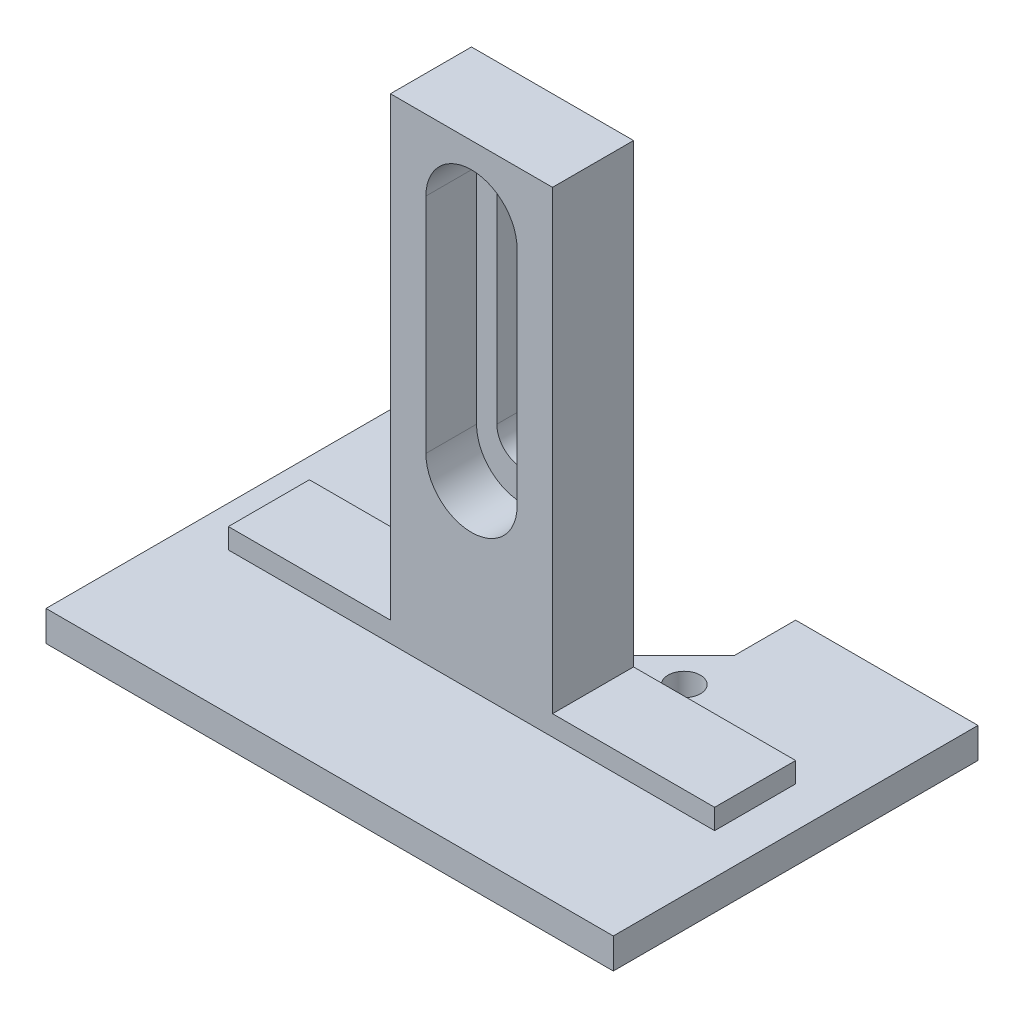
from build123d import *

# Parameters (mm, degrees)
SKETCH_2_R          = 1.6
EXTRUDE_2_DEPTH     = 3
SKETCH_3_W          = 48
SKETCH_3_H          = 8
EXTRUDE_3_DEPTH     = 2
SKETCH_4_W          = 16
SKETCH_4_H          = 8
EXTRUDE_4_DEPTH     = 45
CUT_EXTRUDE_1_DEPTH = 59.966091951
CUT_EXTRUDE_2_DEPTH = 5


with BuildPart() as part:
    # 草图2 → 凸台-拉伸2 (new body)
    with BuildSketch(Plane(origin=(0, 0, 0), x_dir=(1, 0, 0), z_dir=(0, 1, 0))):
        Polygon((-28, 36), (-10, 36), (-10, 29.949747468), (-3.450252532, 23.4), (3.450252532, 23.4), (10, 29.949747468), (10, 36), (28, 36), (28, 0), (-28, 0), align=None)
        with Locations(Location((-10, 25, 0), (0, 0, 270))):
            Circle(SKETCH_2_R, mode=Mode.SUBTRACT)
        with Locations(Location((10, 25, 0), (0, 0, 270))):
            Circle(SKETCH_2_R, mode=Mode.SUBTRACT)
    extrude(amount=-EXTRUDE_2_DEPTH)

    # 草图3 → 凸台-拉伸3 (add)
    with BuildSketch(Plane(origin=(0, 0, 0), x_dir=(1, 0, 0), z_dir=(0, 1, 0))):
        with Locations((0, 18)):
            Rectangle(SKETCH_3_W, SKETCH_3_H)
    extrude(amount=EXTRUDE_3_DEPTH)

    # 草图4 → 凸台-拉伸4 (add)
    with BuildSketch(Plane(origin=(0, 2, 0), x_dir=(1, 0, 0), z_dir=(0, 1, 0))):
        with Locations((0, 18)):
            Rectangle(SKETCH_4_W, SKETCH_4_H)
    extrude(amount=EXTRUDE_4_DEPTH)

    # 草图5 → 切除-拉伸1 (cut, through all)
    with BuildSketch(Plane.XY.offset(-14)):
        with BuildLine():
            Line((2.5, 39), (2.5, 19))
            ThreePointArc((2.5, 19), (0, 16.5), (-2.5, 19))
            Line((-2.5, 19), (-2.5, 39))
            ThreePointArc((-2.5, 39), (0, 41.5), (2.5, 39))
        make_face()
    extrude(amount=-CUT_EXTRUDE_1_DEPTH, mode=Mode.SUBTRACT)

    # 草图6 → 切除-拉伸2 (cut)
    with BuildSketch(Plane.XY.offset(-14)):
        with BuildLine():
            Line((4.5, 40), (4.5, 18))
            ThreePointArc((4.5, 18), (0, 13.5), (-4.5, 18))
            Line((-4.5, 18), (-4.5, 40))
            ThreePointArc((-4.5, 40), (0, 44.5), (4.5, 40))
        make_face()
    extrude(amount=-CUT_EXTRUDE_2_DEPTH, mode=Mode.SUBTRACT)


solid = part.part
